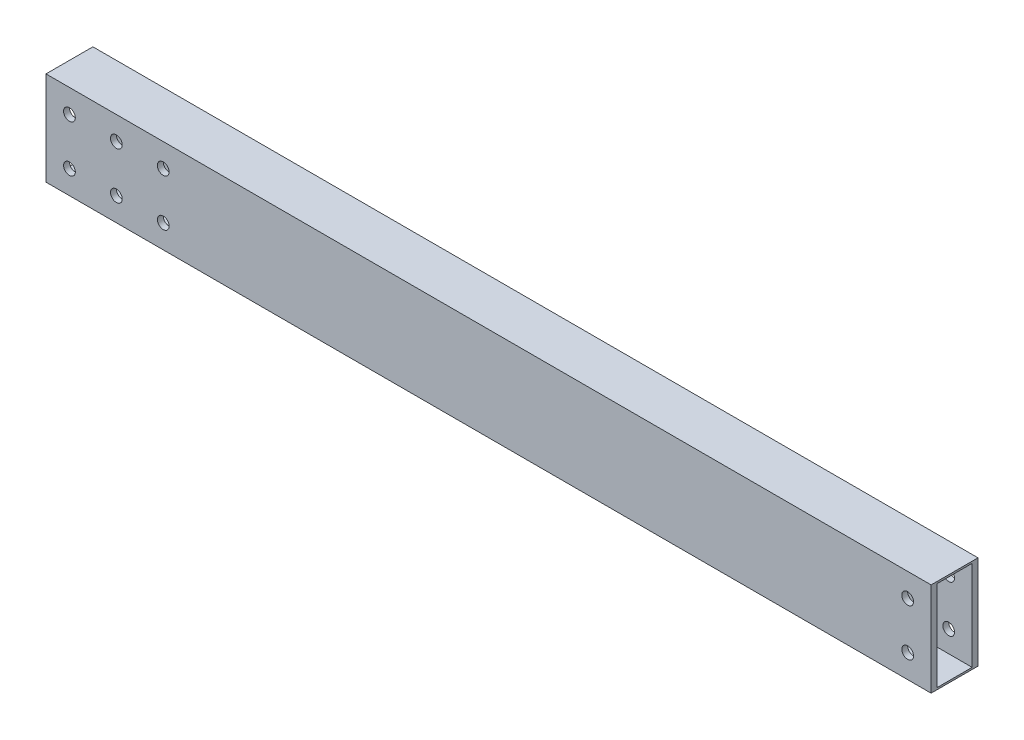
from build123d import *

# Parameters (mm, degrees)
SKETCH1_W               = 25.4
SKETCH1_H               = 50.8
BOSS_EXTRUDE1_DEPTH     = 479.336862
SKETCH2_W               = 19.05
SKETCH2_H               = 48.768
CUT_EXTRUDE1_DEPTH      = 483.689990855
CUT_EXTRUDE4_DEPTH      = 483.689990855
CUT_EXTRUDE4_DEPTH_BACK = 483.689990855
SKETCH5_R               = 3.175


with BuildPart() as part:
    # Sketch1 → Boss-Extrude1 (new body)
    with BuildSketch(Plane(origin=(0, 0, 0), x_dir=(0, 0, -1), z_dir=(1, 0, 0))):
        with Locations((12.7, 25.4)):
            Rectangle(SKETCH1_W, SKETCH1_H)
    extrude(amount=BOSS_EXTRUDE1_DEPTH)

    # Sketch2 → Cut-Extrude1 (cut, through all)
    with BuildSketch(Plane(origin=(479.336862, 0, 0), x_dir=(0, 0, -1), z_dir=(1, 0, 0))):
        with Locations((12.7, 25.4)):
            Rectangle(SKETCH2_W, SKETCH2_H)
    extrude(amount=-CUT_EXTRUDE1_DEPTH, mode=Mode.SUBTRACT)

    # Sketch5 → Cut-Extrude4 (cut, two sides: drawn at the far end of the back side and taken through both)
    with BuildSketch(Plane.XY.offset(-CUT_EXTRUDE4_DEPTH_BACK)):
        with Locations((12.7, 38.1)):
            Circle(SKETCH5_R)
        with Locations((38.1, 38.1)):
            Circle(SKETCH5_R)
        with Locations((12.7, 12.7)):
            Circle(SKETCH5_R)
        with Locations((38.1, 12.7)):
            Circle(SKETCH5_R)
        with Locations((63.5, 38.1)):
            Circle(SKETCH5_R)
        with Locations((63.5, 12.7)):
            Circle(SKETCH5_R)
        with Locations((466.636862, 38.1)):
            Circle(SKETCH5_R)
        with Locations((466.636862, 12.7)):
            Circle(SKETCH5_R)
    extrude(amount=CUT_EXTRUDE4_DEPTH + CUT_EXTRUDE4_DEPTH_BACK, mode=Mode.SUBTRACT)


solid = part.part
